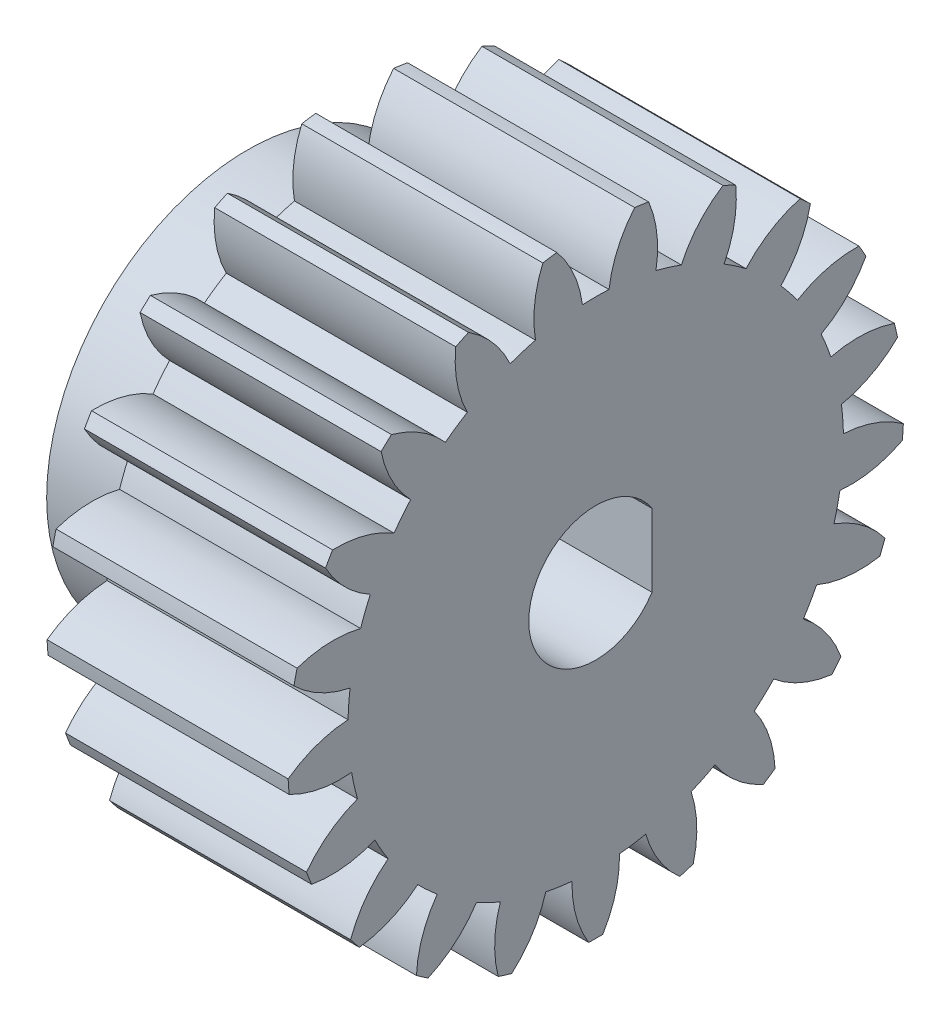
from build123d import *

# Parameters (mm, degrees)
BASPROSKE_W         = 9
BASPROSKE_H         = 11.5
TOOTHCUT_DEPTH      = 19.587630295
TEETHCUTS_COUNT     = 21
TEETHCUTS_ANGLE     = 342.857142857
BORSKE_R            = 2.5
BORE_DEPTH          = 50.0000508
SKETCH1_R           = 7.5
SKETCH1_R_2         = 2.5
BOSS_EXTRUDE1_DEPTH = 4
BOSS_EXTRUDE2_DEPTH = 13


with BuildPart() as part:
    # BasProSke → Base-Revolve (revolve)
    with BuildSketch(Plane(origin=(0, 0, 0), x_dir=(1, 0, 0), z_dir=(0, 1, 0)), mode=Mode.PRIVATE) as base_revolve_sk:
        with Locations((4.5, 5.75)):
            Rectangle(BASPROSKE_W, BASPROSKE_H)
    revolve(base_revolve_sk.sketch.rotate(Axis((-10, 0, 0), (1, 0, 0)), 180), axis=Axis((-10, 0, 0), (1, 0, 0)))

    # TooCutSke → ToothCut (cut, through all)
    with BuildSketch(Plane(origin=(0, 0, 0), x_dir=(0, 0, -1), z_dir=(1, 0, 0))):
        with BuildLine():
            ThreePointArc((0.49526894, 9.235730057), (0, 9.249), (-0.49526894, 9.235730057))
            ThreePointArc((-0.49526894, 9.235730057), (-0.823521057, 10.404716786), (-1.472455249, 11.430954496))
            ThreePointArc((-1.472455249, 11.430954496), (0, 11.5254), (1.472455249, 11.430954496))
            ThreePointArc((1.472455249, 11.430954496), (0.823521057, 10.404716786), (0.49526894, 9.235730057))
        make_face()
    toothcut = extrude(amount=TOOTHCUT_DEPTH, mode=Mode.SUBTRACT)

    # TeethCuts: ToothCut ×21 about axis
    teethcuts_axis = Axis((-10, 0, 0), (1, 0, 0))
    for i in range(1, TEETHCUTS_COUNT):
        add(toothcut.rotate(teethcuts_axis, i * TEETHCUTS_ANGLE / (TEETHCUTS_COUNT - 1)), mode=Mode.SUBTRACT)

    # BorSke → Bore (cut, symmetric)
    with BuildSketch(Plane(origin=(0, 0, 0), x_dir=(0, 0, -1), z_dir=(1, 0, 0))):
        with Locations(Location((0, 0, 0), (0, 0, 180))):
            Circle(BORSKE_R)
    extrude(amount=BORE_DEPTH, both=True, mode=Mode.SUBTRACT)

    # Sketch1 → Boss-Extrude1 (add)
    with BuildSketch(Plane.ZY):
        with Locations(Location((0, 0, 0), (0, 0, 180))):
            Circle(SKETCH1_R)
        Circle(SKETCH1_R_2, mode=Mode.SUBTRACT)
    extrude(amount=BOSS_EXTRUDE1_DEPTH)

    # Sketch2 → Boss-Extrude2 (add, through all)
    with BuildSketch(Plane.ZY.offset(4)):
        with BuildLine():
            Line((-2.1, -1.356465997), (-2.1, 1.356465997))
            ThreePointArc((-2.1, 1.356465997), (-2.5, 0), (-2.1, -1.356465997))
        make_face()
    extrude(amount=-BOSS_EXTRUDE2_DEPTH)


solid = part.part
